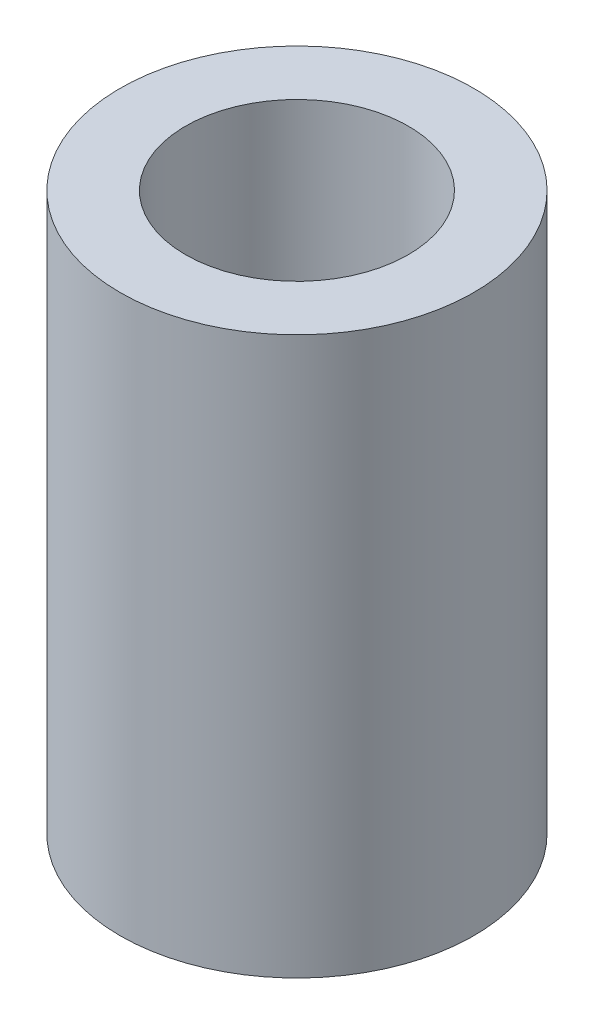
from build123d import *

# Parameters (mm, degrees)
SKETCH1_R           = 4.7625
SKETCH1_R_2         = 3
BOSS_EXTRUDE1_DEPTH = 15


with BuildPart() as part:
    # Sketch1 → Boss-Extrude1 (new body)
    with BuildSketch(Plane(origin=(0, 0, 0), x_dir=(1, 0, 0), z_dir=(0, 1, 0))):
        with Locations(Location((0, 0, 0), (0, 0, 270))):
            Circle(SKETCH1_R)
        with Locations(Location((0, 0, 0), (0, 0, 270))):
            Circle(SKETCH1_R_2, mode=Mode.SUBTRACT)
    extrude(amount=BOSS_EXTRUDE1_DEPTH)


solid = part.part
